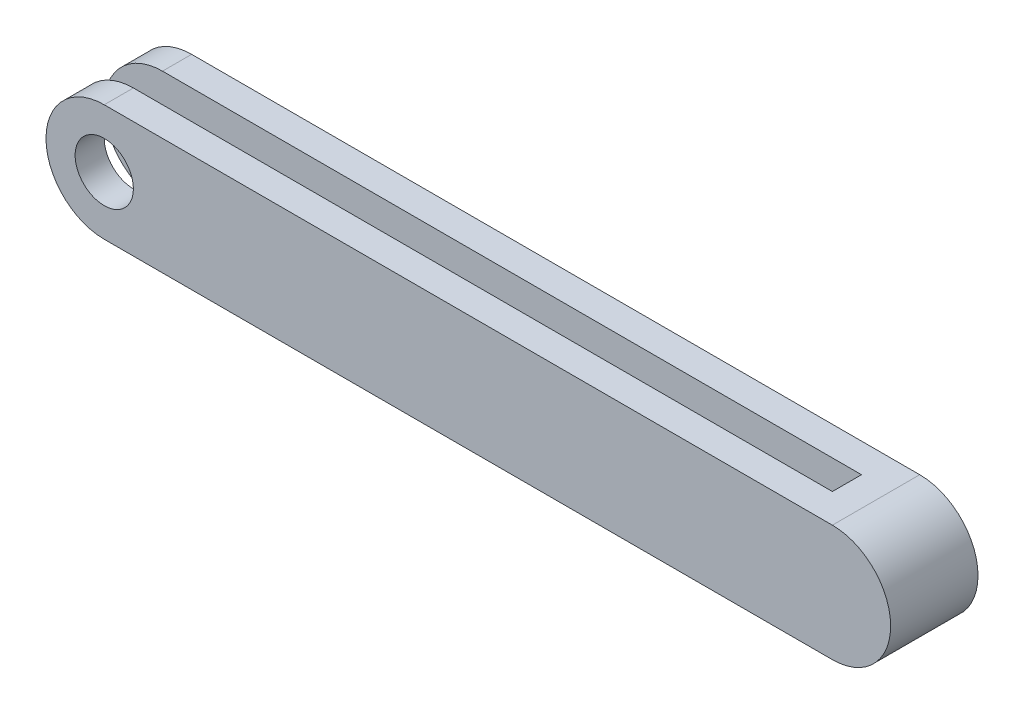
from build123d import *

# Parameters (mm, degrees)
CROQUIS1_R              = 5
SALIENTE_EXTRUIR1_DEPTH = 15
CROQUIS2_W              = 130
CROQUIS2_H              = 5
CORTAR_EXTRUIR1_DEPTH   = 138.295302177


with BuildPart() as part:
    # Croquis1 → Saliente-Extruir1 (new body)
    with BuildSketch(Plane.XY):
        with BuildLine():
            Line((0, 10), (125, 10))
            ThreePointArc((125, 10), (135, 0), (125, -10))
            Line((125, -10), (0, -10))
            ThreePointArc((0, -10), (-10, 0), (0, 10))
        make_face()
        Circle(CROQUIS1_R, mode=Mode.SUBTRACT)
    extrude(amount=SALIENTE_EXTRUIR1_DEPTH)

    # Croquis2 → Cortar-Extruir1 (cut, through all)
    with BuildSketch(Plane(origin=(0, 10, 0), x_dir=(1, 0, 0), z_dir=(0, 1, 0))):
        with Locations((55, -7.5)):
            Rectangle(CROQUIS2_W, CROQUIS2_H)
    extrude(amount=-CORTAR_EXTRUIR1_DEPTH, mode=Mode.SUBTRACT)


solid = part.part
